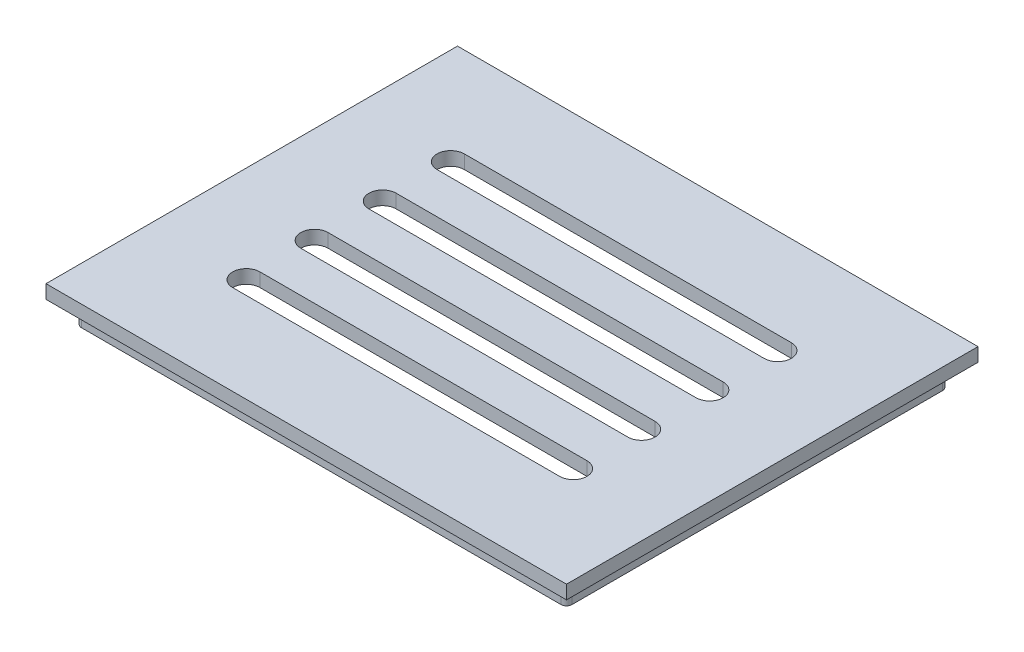
from build123d import *

# Parameters (mm, degrees)
SKETCH1_W           = 90
SKETCH1_H           = 70
SKETCH1_W_2         = 86
SKETCH1_H_2         = 66
EXTRUDE_THIN1_DEPTH = 4
SKETCH2_W           = 95.5
SKETCH2_H           = 75.5
BOSS_EXTRUDE1_DEPTH = 2.5
FILLET1_R           = 1
FILLET2_R           = 0.75


with BuildPart() as part:
    # Sketch1 → Extrude-Thin1 (new body)
    with BuildSketch(Plane(origin=(0, 0, 0), x_dir=(1, 0, 0), z_dir=(0, 1, 0))):
        Rectangle(SKETCH1_W, SKETCH1_H)
        Rectangle(SKETCH1_W_2, SKETCH1_H_2, mode=Mode.SUBTRACT)
    extrude(amount=EXTRUDE_THIN1_DEPTH)

    # Sketch2 → Boss-Extrude1 (add)
    with BuildSketch(Plane(origin=(0, 4, 0), x_dir=(1, 0, 0), z_dir=(0, 1, 0))):
        Rectangle(SKETCH2_W, SKETCH2_H)
        with BuildLine():
            Line((-30, -16.25), (30, -16.25))
            ThreePointArc((30, -16.25), (32.5, -18.75), (30, -21.25))
            Line((30, -21.25), (-30, -21.25))
            ThreePointArc((-30, -21.25), (-32.5, -18.75), (-30, -16.25))
        make_face(mode=Mode.SUBTRACT)
        with BuildLine():
            Line((-30, -3.75), (30, -3.75))
            ThreePointArc((30, -3.75), (32.5, -6.25), (30, -8.75))
            Line((30, -8.75), (-30, -8.75))
            ThreePointArc((-30, -8.75), (-32.5, -6.25), (-30, -3.75))
        make_face(mode=Mode.SUBTRACT)
        with BuildLine():
            Line((-30, 8.75), (30, 8.75))
            ThreePointArc((30, 8.75), (32.5, 6.25), (30, 3.75))
            Line((30, 3.75), (-30, 3.75))
            ThreePointArc((-30, 3.75), (-32.5, 6.25), (-30, 8.75))
        make_face(mode=Mode.SUBTRACT)
        with BuildLine():
            Line((-30, 21.25), (30, 21.25))
            ThreePointArc((30, 21.25), (32.5, 18.75), (30, 16.25))
            Line((30, 16.25), (-30, 16.25))
            ThreePointArc((-30, 16.25), (-32.5, 18.75), (-30, 21.25))
        make_face(mode=Mode.SUBTRACT)
    extrude(amount=BOSS_EXTRUDE1_DEPTH)

    # Fillet1
    fillet1_edges = [part.edges().sort_by_distance(p)[0] for p in [
        (45, 2, 35),
        (-45, 2, 35),
        (-45, 2, -35),
        (45, 2, -35),
    ]]
    fillet(fillet1_edges, radius=FILLET1_R)

    # Fillet2
    fillet2_edges = [part.edges().sort_by_distance(p)[0] for p in [
        (-45, 4, 0),
        (0, 4, -35),
        (45, 4, 0),
        (0, 4, 35),
        (-44.707106781, 4, -34.707106781),
        (44.707106781, 4, -34.707106781),
        (-44.707106781, 4, 34.707106781),
        (44.707106781, 4, 34.707106781),
    ]]
    fillet(fillet2_edges, radius=FILLET2_R)


solid = part.part
